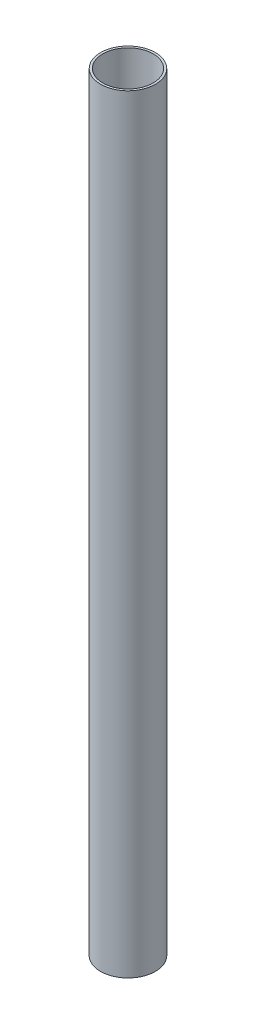
from build123d import *

# Parameters (mm, degrees)
SKETCH1_R           = 12.5
SKETCH1_R_2         = 11.5
BOSS_EXTRUDE1_DEPTH = 350


with BuildPart() as part:
    # Sketch1 → Boss-Extrude1 (new body)
    with BuildSketch(Plane(origin=(0, 0, 0), x_dir=(1, 0, 0), z_dir=(0, 1, 0))):
        with Locations(Location((0, 0, 0), (0, 0, 270))):
            Circle(SKETCH1_R)
        with Locations(Location((0, 0, 0), (0, 0, 270))):
            Circle(SKETCH1_R_2, mode=Mode.SUBTRACT)
    extrude(amount=BOSS_EXTRUDE1_DEPTH)


solid = part.part
